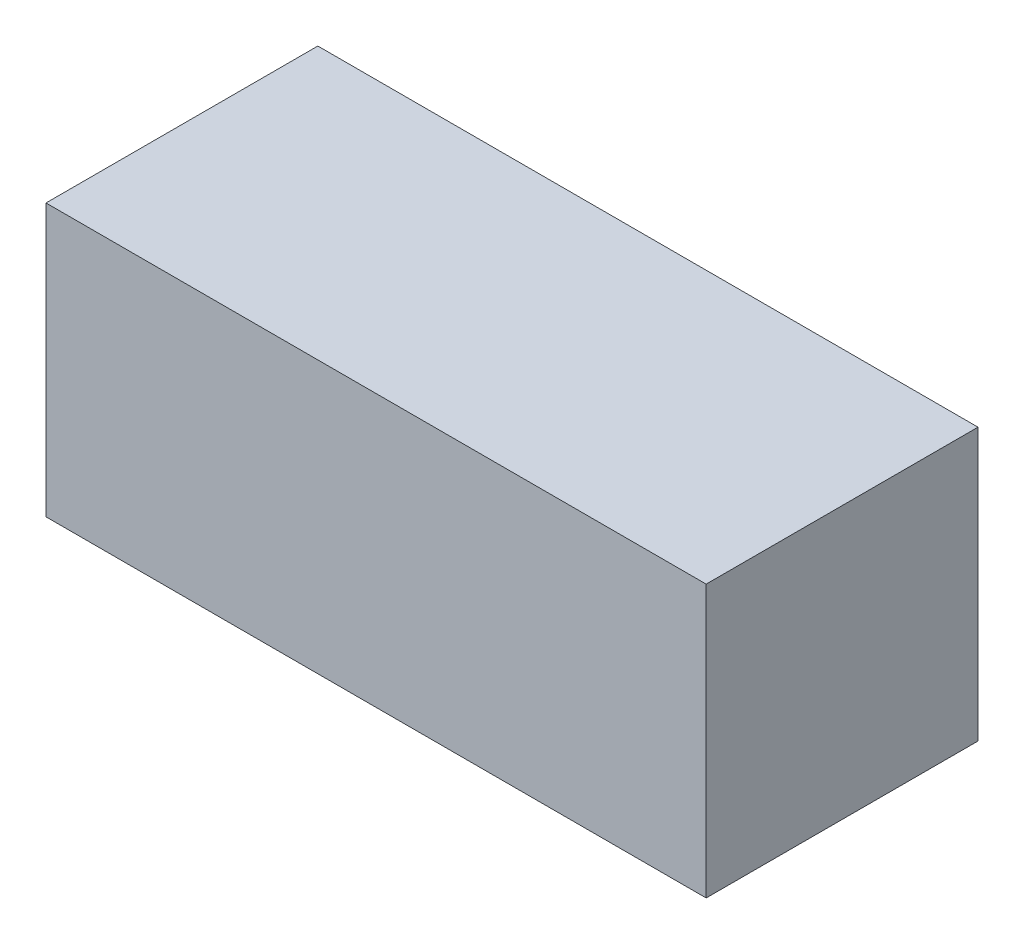
from build123d import *

# Parameters (mm, degrees)
SKETCH_1_W      = 170
SKETCH_1_H      = 70
EXTRUDE_1_DEPTH = 35


with BuildPart() as part:
    # Эскиз1 → Бобышка-Вытянуть1 (new, symmetric)
    with BuildSketch(Plane.XY):
        Rectangle(SKETCH_1_W, SKETCH_1_H)
    extrude(amount=EXTRUDE_1_DEPTH, both=True)


solid = part.part
